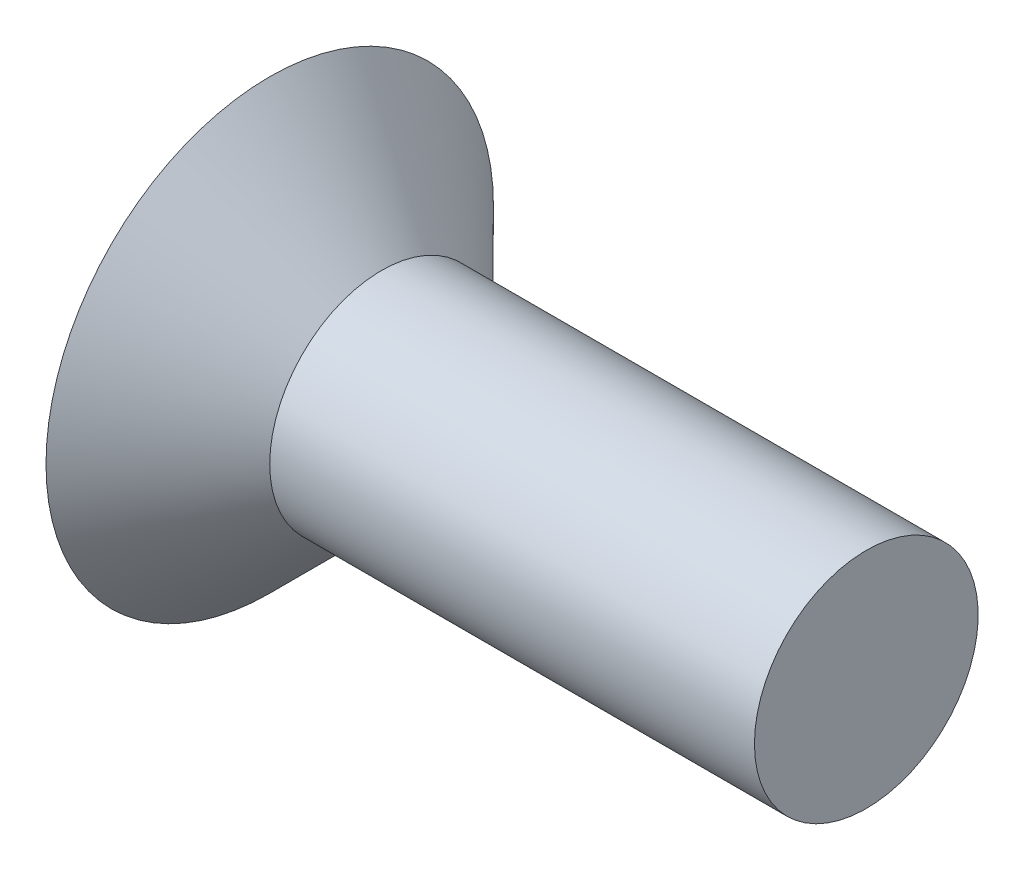
from build123d import *

# Parameters (mm, degrees)
CUT_EXTRUDE_1_DEPTH = 1


with BuildPart() as part:
    # 草图1 → 旋转1 (revolve)
    with BuildSketch(Plane.XY, mode=Mode.PRIVATE) as revolve_1_sk:
        Polygon((0, 0), (0, 3), (1.5, 1.5), (8, 1.5), (8, 0), align=None)
    revolve(revolve_1_sk.sketch.rotate(Axis((0, 0, 0), (1, 0, 0)), 90), axis=Axis((0, 0, 0), (1, 0, 0)))

    # 草图2 → 切除-拉伸1 (cut)
    with BuildSketch(Plane.ZY):
        Polygon((0, 1.154700538), (-1, 0.577350269), (-1, -0.577350269), (0, -1.154700538), (1, -0.577350269), (1, 0.577350269), align=None)
    extrude(amount=-CUT_EXTRUDE_1_DEPTH, mode=Mode.SUBTRACT)


solid = part.part
